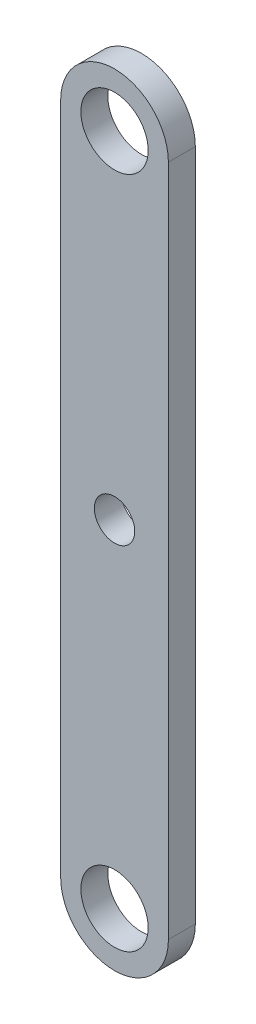
from build123d import *

# Parameters (mm, degrees)
BOSS_EXTRUDE1_DEPTH = 10
SKETCH2_R           = 12.5
CUT_EXTRUDE1_DEPTH  = 271.924343683
SKETCH3_R           = 7.5
CUT_EXTRUDE2_DEPTH  = 10


with BuildPart() as part:
    # Sketch1 → Boss-Extrude1 (new body)
    with BuildSketch(Plane.XY):
        with BuildLine():
            Line((-20, 0), (-20, 250))
            ThreePointArc((-20, 250), (0, 270), (20, 250))
            Line((20, 250), (20, 0))
            ThreePointArc((20, 0), (0, -20), (-20, 0))
        make_face()
    extrude(amount=BOSS_EXTRUDE1_DEPTH)

    # Sketch2 → Cut-Extrude1 (cut, through all)
    with BuildSketch(Plane(origin=(0, 0, 0), x_dir=(-1, 0, 0), z_dir=(0, 0, -1))):
        Circle(SKETCH2_R)
        with Locations((0, 250)):
            Circle(SKETCH2_R)
    extrude(amount=-CUT_EXTRUDE1_DEPTH, mode=Mode.SUBTRACT)

    # Sketch3 → Cut-Extrude2 (cut)
    with BuildSketch(Plane(origin=(0, 0, 0), x_dir=(-1, 0, 0), z_dir=(0, 0, -1))):
        with Locations((0, 125)):
            Circle(SKETCH3_R)
    extrude(amount=-CUT_EXTRUDE2_DEPTH, mode=Mode.SUBTRACT)


solid = part.part
